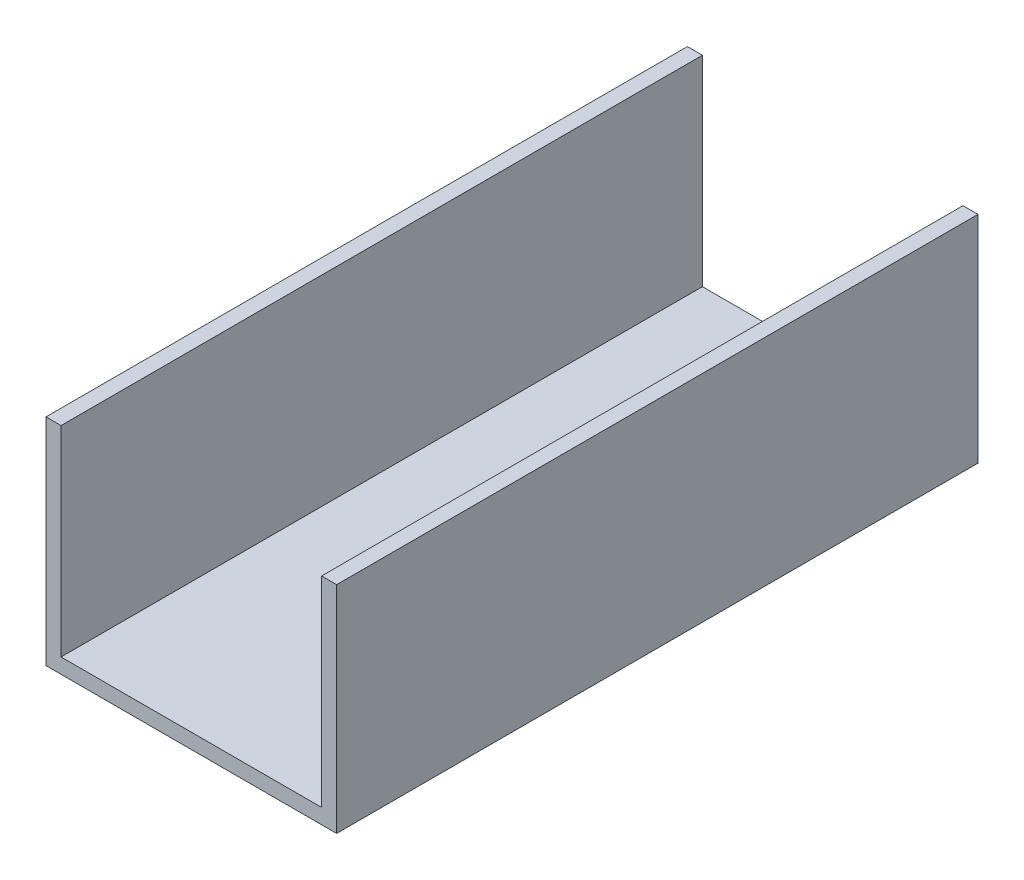
from build123d import *

# Parameters (mm, degrees)
BOSS_EXTRUDE1_DEPTH = 203.2


with BuildPart() as part:
    # Sketch1 → Boss-Extrude1 (new body)
    with BuildSketch(Plane.XY):
        Polygon((87.3125, 68.2625), (92.075, 68.2625), (92.075, 0), (0, 0), (0, 68.2625), (4.7625, 68.2625), (4.7625, 4.7625), (87.3125, 4.7625), align=None)
    extrude(amount=BOSS_EXTRUDE1_DEPTH)


solid = part.part
